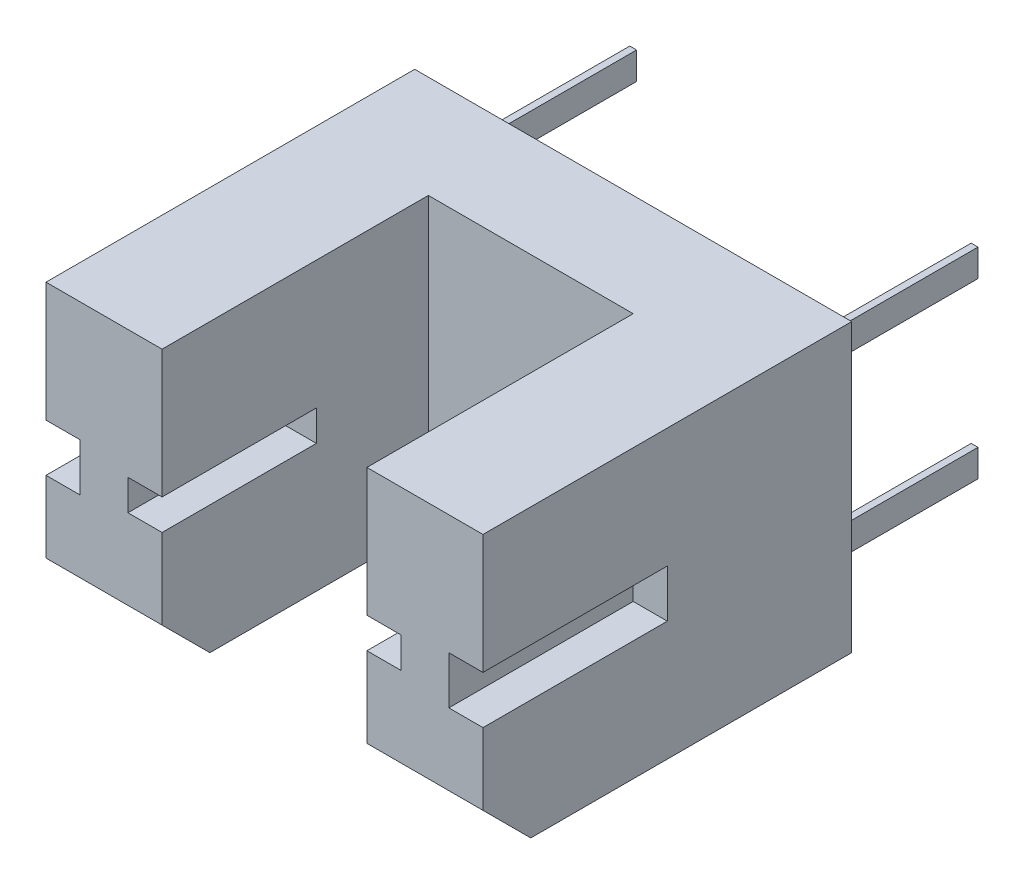
from build123d import *

# Parameters (mm, degrees)
EXTRUDE_1_DEPTH      = 2.1
EXTRUDE_1_DEPTH_BACK = 2.1
SKETCH_3_W           = 2.7
SKETCH_3_H           = 0.7
CUT_EXTRUDE_1_DEPTH  = 0.5
SKETCH_4_W           = 2.26
SKETCH_4_H           = 0.45
CUT_EXTRUDE_2_DEPTH  = 0.5
CHAMFER_1_SIZE       = 0.7
CUT_EXTRUDE_3_DEPTH  = 0.5
EXTRUDE_3_DEPTH      = 0.8
FILLET_1_R           = 0.2
FILLET_2_R           = 0.1
SKETCH_2_W           = 0.1
SKETCH_2_H           = 0.4
EXTRUDE_2_DEPTH      = 3


with BuildPart() as part:
    # Эскиз1 → Бобышка-Вытянуть1 (new, two sides: drawn at the far end of the back side and taken through both)
    with BuildSketch(Plane(origin=(0, 0, 0), x_dir=(1, 0, 0), z_dir=(0, 1, 0)).offset(-EXTRUDE_1_DEPTH_BACK)):
        Polygon((3.2, 0), (-3.2, 0), (-3.2, -5.4), (-1.5, -5.4), (-1.5, -1.5), (1.5, -1.5), (1.5, -5.4), (3.2, -5.4), align=None)
    extrude(amount=EXTRUDE_1_DEPTH + EXTRUDE_1_DEPTH_BACK)

    # Эскиз3 → Вырез-Вытянуть1 (cut)
    with BuildSketch(Plane(origin=(3.2, 0, 0), x_dir=(0, 0, -1), z_dir=(1, 0, 0))):
        with Locations((-4.05, 0)):
            Rectangle(SKETCH_3_W, SKETCH_3_H)
    cut_extrude_1 = extrude(amount=-CUT_EXTRUDE_1_DEPTH, mode=Mode.SUBTRACT)

    # Эскиз4 → Вырез-Вытянуть2 (cut)
    with BuildSketch(Plane.ZY.offset(-1.5)):
        with Locations((4.27, 0)):
            Rectangle(SKETCH_4_W, SKETCH_4_H)
    cut_extrude_2 = extrude(amount=-CUT_EXTRUDE_2_DEPTH, mode=Mode.SUBTRACT)

    # Зеркальное отражение1: Вырез-Вытянуть1, Вырез-Вытянуть2 across plane
    add(cut_extrude_1.mirror(Plane(origin=(0, 0, 0), x_dir=(0, 0, 1), z_dir=(1, 0, 0))), mode=Mode.SUBTRACT)
    add(cut_extrude_2.mirror(Plane(origin=(0, 0, 0), x_dir=(0, 0, 1), z_dir=(1, 0, 0))), mode=Mode.SUBTRACT)

    # Фаска1
    chamfer_1_edges = [part.edges().sort_by_distance(p)[0] for p in [
        (-2.35, -2.1, 5.4),
        (2.35, -2.1, 5.4),
    ]]
    chamfer(chamfer_1_edges, length=CHAMFER_1_SIZE)

    # Эскиз6 → Вырез-Вытянуть3 (cut)
    with BuildSketch(Plane(origin=(0, 0, 0), x_dir=(-1, 0, 0), z_dir=(0, 0, -1))):
        with BuildLine():
            Line((2.9, -1.6), (2.9, 1.6))
            Line((2.9, 1.6), (1.9, 1.6))
            Line((1.9, 1.6), (1.9, 0.8))
            Line((1.9, 0.8), (1.5, 0.8))
            Line((1.5, 0.8), (1.5, 1.6))
            Line((1.5, 1.6), (0.829156198, 1.6))
            ThreePointArc((0.829156198, 1.6), (0, 0.35), (-0.829156198, 1.6))
            Line((-0.829156198, 1.6), (-1.5, 1.6))
            Line((-1.5, 1.6), (-1.5, 0.8))
            Line((-1.5, 0.8), (-1.9, 0.8))
            Line((-1.9, 0.8), (-1.9, 1.6))
            Line((-1.9, 1.6), (-2.9, 1.6))
            Line((-2.9, 1.6), (-2.9, -1.6))
            Line((-2.9, -1.6), (-1.9, -1.6))
            Line((-1.9, -1.6), (-1.9, -0.8))
            Line((-1.9, -0.8), (-1.5, -0.8))
            Line((-1.5, -0.8), (-1.5, -1.6))
            Line((-1.5, -1.6), (-0.487339717, -1.6))
            ThreePointArc((-0.487339717, -1.6), (0, -0.65), (0.487339717, -1.6))
            Line((0.487339717, -1.6), (1.5, -1.6))
            Line((1.5, -1.6), (1.5, -0.8))
            Line((1.5, -0.8), (1.9, -0.8))
            Line((1.9, -0.8), (1.9, -1.6))
            Line((1.9, -1.6), (2.9, -1.6))
        make_face()
    extrude(amount=-CUT_EXTRUDE_3_DEPTH, mode=Mode.SUBTRACT)

    # Эскиз5 → Бобышка-Вытянуть3 (add)
    with BuildSketch(Plane(origin=(0, 0, 0), x_dir=(-1, 0, 0), z_dir=(0, 0, -1))):
        with BuildLine():
            Line((0.433012702, -1.5), (-0.433012702, -1.5))
            ThreePointArc((-0.433012702, -1.5), (0, -0.75), (0.433012702, -1.5))
        make_face()
        with BuildLine():
            Line((-0.683739717, 1.4), (0.683739717, 1.4))
            ThreePointArc((0.683739717, 1.4), (0, 0.55), (-0.683739717, 1.4))
        make_face()
    extrude(amount=EXTRUDE_3_DEPTH)

    # Скругление1
    fillet_1_edges = [part.edges().sort_by_distance(p)[0] for p in [
        (0, 0.55, -0.8),
        (0, 1.4, -0.8),
    ]]
    fillet(fillet_1_edges, radius=FILLET_1_R)

    # Скругление2
    fillet_2_edges = [part.edges().sort_by_distance(p)[0] for p in [
        (0, -0.75, -0.8),
        (0, -1.5, -0.8),
    ]]
    fillet(fillet_2_edges, radius=FILLET_2_R)

    # Эскиз2 → Бобышка-Вытянуть2 (add)
    with BuildSketch(Plane(origin=(0, 0, 0.5), x_dir=(-1, 0, 0), z_dir=(0, 0, -1))):
        with Locations((-2.5, 1.27)):
            Rectangle(SKETCH_2_W, SKETCH_2_H)
        with Locations((-2.5, -1.27)):
            Rectangle(SKETCH_2_W, SKETCH_2_H)
        with Locations((2.5, -1.27)):
            Rectangle(SKETCH_2_W, SKETCH_2_H)
        with Locations((2.5, 1.27)):
            Rectangle(SKETCH_2_W, SKETCH_2_H)
    extrude(amount=EXTRUDE_2_DEPTH)


solid = part.part
